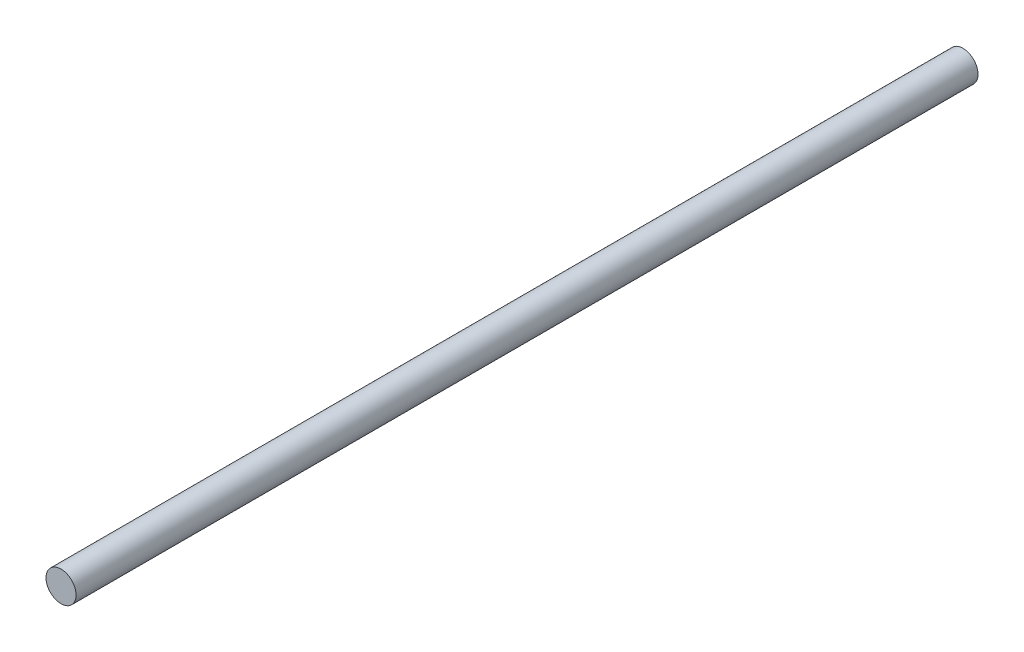
from build123d import *

# Parameters (mm, degrees)
SKETCH1_R           = 1.5
BOSS_EXTRUDE1_DEPTH = 90


with BuildPart() as part:
    # Sketch1 → Boss-Extrude1 (new body)
    with BuildSketch(Plane.XY):
        with Locations(Location((0, 0, 0), (0, 0, 180))):
            Circle(SKETCH1_R)
    extrude(amount=BOSS_EXTRUDE1_DEPTH)


solid = part.part
